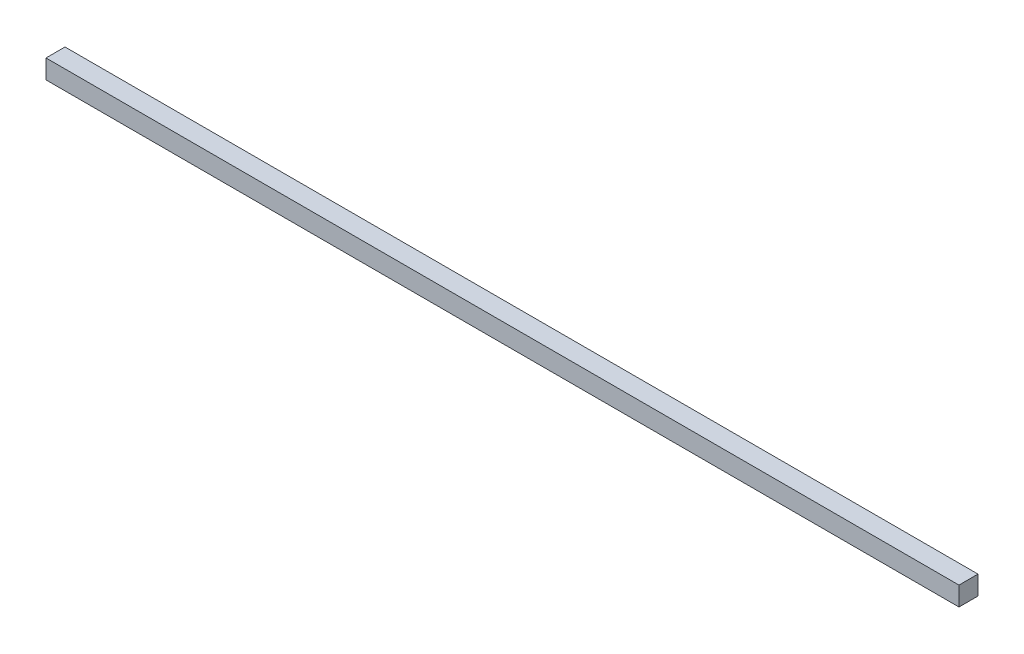
from build123d import *

# Parameters (mm, degrees)
SKETCH_1_W      = 1440
SKETCH_1_H      = 30
EXTRUDE_1_DEPTH = 30


with BuildPart() as part:
    # Эскиз1 → Бобышка-Вытянуть1 (new body)
    with BuildSketch(Plane.XY):
        with Locations((720, 42.996070727)):
            Rectangle(SKETCH_1_W, SKETCH_1_H)
    extrude(amount=EXTRUDE_1_DEPTH)


solid = part.part
